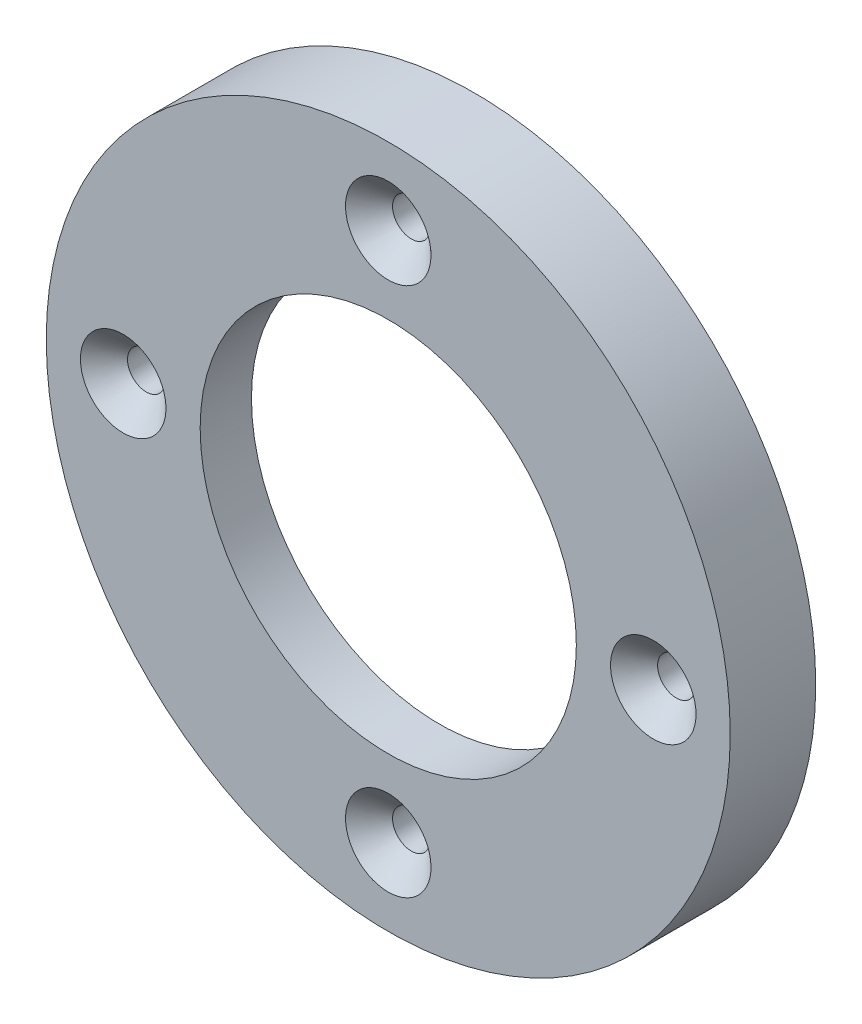
from build123d import *

# Parameters (mm, degrees)
EXTRUDE_1_DEPTH          = 3
SKETCH_2_R               = 11
CUT_EXTRUDE_1_DEPTH      = 26.632011236
EXTRUDE_START            = -5
SKETCH_5_R               = 20
SKETCH_5_R_2             = 18
EXTRUDE_2_DEPTH          = 5
PATTERN_CIRCULAR_1_COUNT = 4
CHAMFER_1_SIZE           = 0.5


with BuildPart() as part:
    # Эскиз1 → Бобышка-Вытянуть1 (new body)
    with BuildSketch(Plane.XY):
        with BuildLine():
            ThreePointArc((-17.685483871, -3.350173167), (-12.727922061, -12.727922061), (-3.350173167, -17.685483871))
            ThreePointArc((-3.350173167, -17.685483871), (10.136595409, -14.874455738), (17.685483871, -3.350173167))
            ThreePointArc((17.685483871, -3.350173167), (12.727922061, 12.727922061), (-3.350173167, 17.685483871))
            ThreePointArc((-3.350173167, 17.685483871), (-14.874455738, 10.136595409), (-17.685483871, -3.350173167))
        make_face()
    extrude(amount=EXTRUDE_1_DEPTH)

    # Эскиз2 → Вырез-Вытянуть1 (cut, through all)
    with BuildSketch(Plane.XY.offset(3)):
        Circle(SKETCH_2_R)
    extrude(amount=-CUT_EXTRUDE_1_DEPTH, mode=Mode.SUBTRACT)

    # Эскиз5 → Бобышка-Вытянуть2 (add)
    with BuildSketch(Plane.XY.offset(3).offset(EXTRUDE_START)):
        Circle(SKETCH_5_R)
        Circle(SKETCH_5_R_2, mode=Mode.SUBTRACT)
    extrude(amount=EXTRUDE_2_DEPTH)

    # Эскиз6 → Вырез-Повернуть1 (revolve, cut)
    with BuildSketch(Plane(origin=(0, 0, 0), x_dir=(1, 0, 0), z_dir=(0, 1, 0))):
        Polygon((-16.6, -1.648035715), (-18, -3), (-15.5, -3), (-15.5, -1.648035715), (-15.5, 2), (-16.6, 2), align=None)
    cut_revolve_1 = revolve(axis=Axis((-15.5, 0, -24.0808518), (0, 0, 1)), mode=Mode.SUBTRACT)

    # Круговой массив1: Вырез-Повернуть1 ×4 about axis
    pattern_circular_1_axis = Axis((0, 0, 0), (0, 0, 1))
    for i in range(1, PATTERN_CIRCULAR_1_COUNT):
        add(cut_revolve_1.rotate(pattern_circular_1_axis, i * 360 / PATTERN_CIRCULAR_1_COUNT), mode=Mode.SUBTRACT)

    # Фаска1
    chamfer_1_edges = [part.edges().sort_by_distance(p)[0] for p in [
        (-18, 0, -2),
    ]]
    chamfer(chamfer_1_edges, length=CHAMFER_1_SIZE)


solid = part.part
